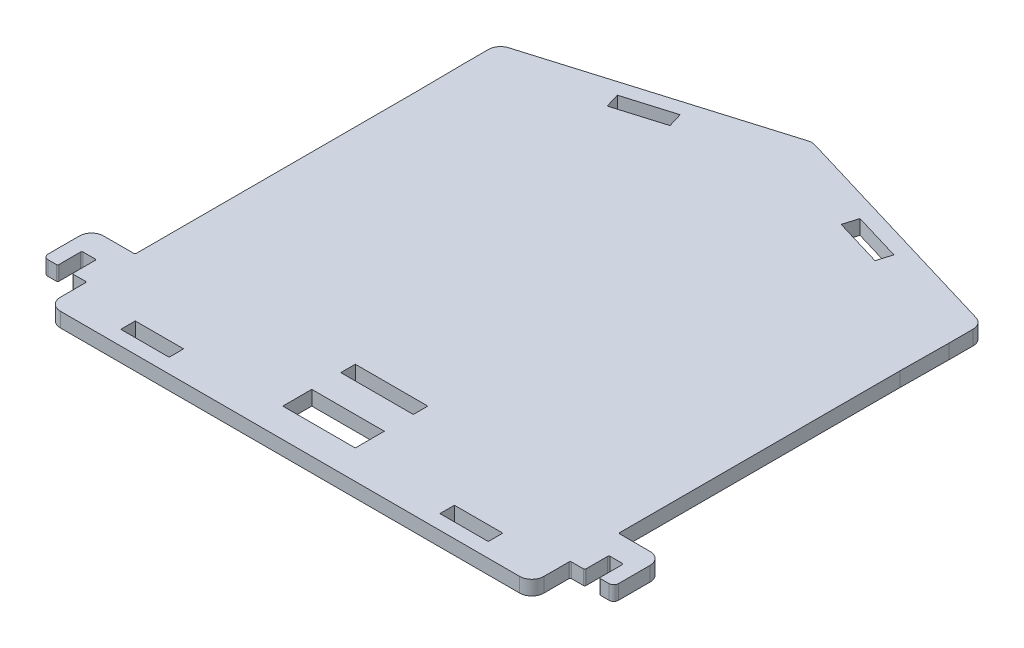
from build123d import *

# Parameters (mm, degrees)
SALIENTE_EXTRUIR1_DEPTH = 3
CROQUIS4_W              = 15
CROQUIS4_H              = 6
CROQUIS4_W_2            = 10
CROQUIS4_H_2            = 3
CORTAR_EXTRUIR1_DEPTH   = 3
SALIENTE_EXTRUIR2_DEPTH = 3
REDONDEO1_R             = 1
REDONDEO2_R             = 0.25


with BuildPart() as part:
    # Croquis3 → Saliente-Extruir1 (new body)
    with BuildSketch(Plane(origin=(0, 0, 0), x_dir=(1, 0, 0), z_dir=(0, 1, 0))):
        with BuildLine():
            Line((-50, -45), (50, -45))
            Line((50, -45), (50, -40.05))
            Line((50, -40.05), (53, -40.05))
            Line((53, -40.05), (53, -35.05))
            Line((53, -35.05), (56, -35.05))
            Line((56, -35.05), (56, -40.05))
            Line((56, -40.05), (59, -40.05))
            Line((59, -40.05), (59, -32.55))
            ThreePointArc((59, -32.55), (58.267766953, -30.782233047), (56.5, -30.05))
            Line((56.5, -30.05), (50, -30.05))
            Line((50, -30.05), (50, 28.189923373))
            Line((50, 28.189923373), (50.1, 38.189923373))
            Line((50.1, 38.189923373), (50.1, 43.139923373))
            ThreePointArc((50.1, 43.139923373), (49.605586306, 44.632445926), (48.317901143, 45.534629607))
            Line((48.317901143, 45.534629607), (0.615531773, 59.835166775))
            ThreePointArc((0.615531773, 59.835166775), (0, 59.908733938), (-0.615531773, 59.835166775))
            Line((-0.615531773, 59.835166775), (-48.317901143, 45.534629607))
            ThreePointArc((-48.317901143, 45.534629607), (-49.605586306, 44.632445926), (-50.1, 43.139923373))
            Line((-50.1, 43.139923373), (-50.1, 38.189923373))
            Line((-50.1, 38.189923373), (-50, 28.189923373))
            Line((-50, 28.189923373), (-50, -30.05))
            Line((-50, -30.05), (-56.5, -30.05))
            ThreePointArc((-56.5, -30.05), (-58.267766953, -30.782233047), (-59, -32.55))
            Line((-59, -32.55), (-59, -40.05))
            Line((-59, -40.05), (-56, -40.05))
            Line((-56, -40.05), (-56, -35.05))
            Line((-56, -35.05), (-53, -35.05))
            Line((-53, -35.05), (-53, -40.05))
            Line((-53, -40.05), (-50, -40.05))
            Line((-50, -40.05), (-50, -45))
        make_face()
        Polygon((-23.595339952, 49.778243466), (-18.595339952, 51.277177099), (-17.695979772, 48.277177099), (-27.695979772, 45.279309832), (-28.595339952, 48.279309832), align=None, mode=Mode.SUBTRACT)
        Polygon((28.595339952, 48.279309832), (27.695979772, 45.279309832), (17.695979772, 48.277177099), (18.595339952, 51.277177099), (23.595339952, 49.778243466), align=None, mode=Mode.SUBTRACT)
    extrude(amount=SALIENTE_EXTRUIR1_DEPTH)

    # Croquis4 → Cortar-Extruir1 (cut, symmetric)
    with BuildSketch(Plane(origin=(0, 3, 0), x_dir=(1, 0, 0), z_dir=(0, 1, 0))):
        with Locations((0, -39)):
            Rectangle(CROQUIS4_W, CROQUIS4_H)
        with Locations((-33, -43.5)):
            Rectangle(CROQUIS4_W_2, CROQUIS4_H_2)
        with Locations((33, -43.5)):
            Rectangle(CROQUIS4_W_2, CROQUIS4_H_2)
        with Locations((0, -28.5)):
            Rectangle(CROQUIS4_W, CROQUIS4_H_2)
    extrude(amount=CORTAR_EXTRUIR1_DEPTH, both=True, mode=Mode.SUBTRACT)

    # Croquis5 → Saliente-Extruir2 (add)
    with BuildSketch(Plane(origin=(0, 0, 0), x_dir=(1, 0, 0), z_dir=(0, 1, 0))):
        with BuildLine():
            Line((-50, -45), (50, -45))
            Line((50, -45), (50, -45.5))
            ThreePointArc((50, -45.5), (49.267766953, -47.267766953), (47.5, -48))
            Line((47.5, -48), (-47.5, -48))
            ThreePointArc((-47.5, -48), (-49.267766953, -47.267766953), (-50, -45.5))
            Line((-50, -45.5), (-50, -45))
        make_face()
    extrude(amount=SALIENTE_EXTRUIR2_DEPTH)

    # Redondeo1
    redondeo1_edges = [part.edges().sort_by_distance(p)[0] for p in [
        (-59, 1.5, 40.05),
        (59, 1.5, 40.05),
    ]]
    fillet(redondeo1_edges, radius=REDONDEO1_R)

    # Redondeo2
    redondeo2_edges = [part.edges().sort_by_distance(p)[0] for p in [
        (-50, 1.5, 40.05),
        (-53, 1.5, 40.05),
        (-53, 1.5, 35.05),
        (-56, 1.5, 35.05),
        (-56, 1.5, 40.05),
        (-50, 1.5, 30.05),
        (50, 1.5, 30.05),
        (56, 1.5, 40.05),
        (56, 1.5, 35.05),
        (53, 1.5, 35.05),
        (53, 1.5, 40.05),
        (50, 1.5, 40.05),
    ]]
    fillet(redondeo2_edges, radius=REDONDEO2_R)


solid = part.part
